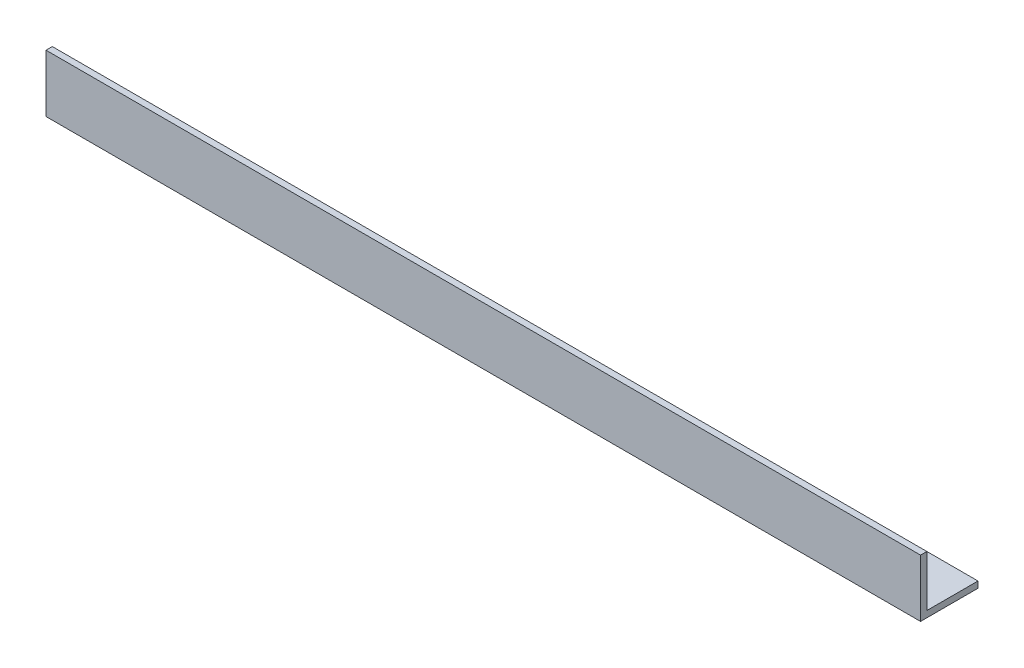
from build123d import *

# Parameters (mm, degrees)
SKETCH1_W           = 386.588
SKETCH1_H           = 2.794
SKETCH1_H_2         = 22.606
BOSS_EXTRUDE1_DEPTH = 2.794
SKETCH2_W           = 386.588
SKETCH2_H           = 2.794
BOSS_EXTRUDE3_DEPTH = 22.606


with BuildPart() as part:
    # Sketch1 → Boss-Extrude1 (new body)
    with BuildSketch(Plane(origin=(0, 0, 0), x_dir=(1, 0, 0), z_dir=(0, 1, 0))):
        with Locations((0, -11.303)):
            Rectangle(SKETCH1_W, SKETCH1_H)
        with Locations((0, 1.397)):
            Rectangle(SKETCH1_W, SKETCH1_H_2)
    extrude(amount=BOSS_EXTRUDE1_DEPTH)

    # Sketch2 → Boss-Extrude3 (add)
    with BuildSketch(Plane(origin=(0, 2.794, 0), x_dir=(1, 0, 0), z_dir=(0, 1, 0))):
        with Locations((0, -11.303)):
            Rectangle(SKETCH2_W, SKETCH2_H)
    extrude(amount=BOSS_EXTRUDE3_DEPTH)


solid = part.part
